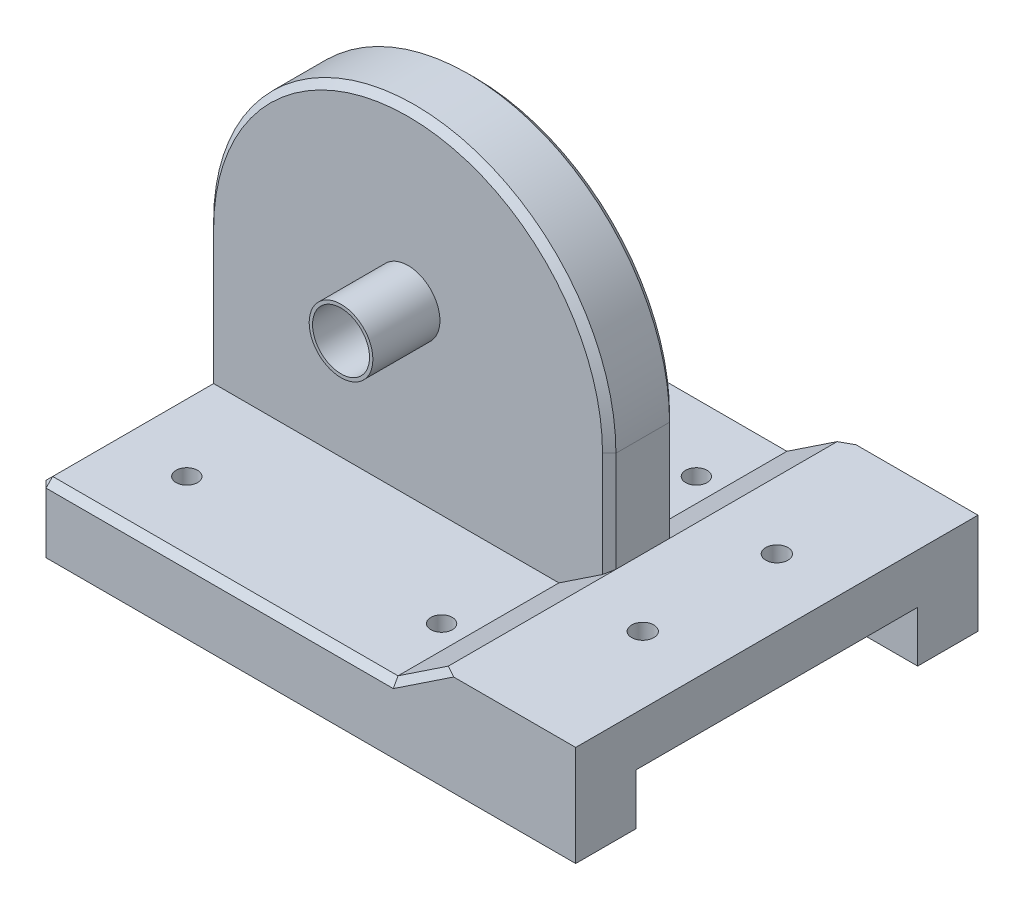
from build123d import *

# Parameters (mm, degrees)
SKETCH_1_W          = 60
SKETCH_1_H          = 50
EXTRUDE_1_DEPTH     = 10
SKETCH_8_W          = 80
SKETCH_8_H          = 60
EXTRUDE_2_DEPTH     = 10
SKETCH_9_R          = 4.75
SKETCH_9_R_2        = 4.25
EXTRUDE_3_DEPTH     = 10
SKETCH_11_W         = 20
SKETCH_11_H         = 7.6
CUT_EXTRUDE_1_DEPTH = 21
SKETCH_12_W         = 20
SKETCH_12_H         = 5
EXTRUDE_4_DEPTH     = 30
HOLE_WIZARD_4_D     = 3.3
EXTRUDE_START       = -60
EXTRUDE_5_DEPTH     = 60
FILLET_1_RADIUS     = 30
FILLET_1_LENGTH     = 10
CHAMFER_1_SIZE      = 1
HOLE_WIZARD_5_D     = 3.2


with BuildPart() as part:
    # 草图1 → 凸台-拉伸1 (new body)
    with BuildSketch(Plane.XY):
        Rectangle(SKETCH_1_W, SKETCH_1_H)
    extrude(amount=EXTRUDE_1_DEPTH)

    # 草图3 → 孔1 (revolve, cut)
    with BuildSketch(Plane(origin=(0, 0, 10), x_dir=(0, -1, 0), z_dir=(1, 0, 0))):
        Polygon((0, 0), (0, 10), (4, 10), (4, 0.603553391), (4.25, 0), align=None)
    revolve(axis=Axis((0, 0, 16.445314094), (0, 0, -1)), mode=Mode.SUBTRACT)

    # 草图8 → 凸台-拉伸2 (add)
    with BuildSketch(Plane.XZ.offset(25)):
        with Locations((10, 5)):
            Rectangle(SKETCH_8_W, SKETCH_8_H)
    extrude(amount=EXTRUDE_2_DEPTH)

    # 草图9 → 凸台-拉伸3 (add)
    with BuildSketch(Plane.XY.offset(10)):
        with Locations(Location((0, 0, 0), (0, 0, 180))):
            Circle(SKETCH_9_R)
        Circle(SKETCH_9_R_2, mode=Mode.SUBTRACT)
    extrude(amount=EXTRUDE_3_DEPTH)

    # 草图11 → 切除-拉伸1 (cut, symmetric)
    with BuildSketch(Plane.XY.offset(5)):
        with Locations((40, -31.2)):
            Rectangle(SKETCH_11_W, SKETCH_11_H)
    extrude(amount=CUT_EXTRUDE_1_DEPTH, both=True, mode=Mode.SUBTRACT)

    # 草图12 → 凸台-拉伸4 (add, symmetric)
    with BuildSketch(Plane.XY.offset(5)):
        with Locations((40, -22.5)):
            Rectangle(SKETCH_12_W, SKETCH_12_H)
    extrude(amount=EXTRUDE_4_DEPTH, both=True)

    # 孔4 (through all)
    with Locations(Plane(origin=(0, -20, 0), x_dir=(1, 0, 0), z_dir=(0, 1, 0))):
        with Locations((40, -15), (40, 5)):
            Hole(HOLE_WIZARD_4_D / 2)

    # 草图15 → 凸台-拉伸5 (add)
    with BuildSketch(Plane.XY.offset(35).offset(EXTRUDE_START)):
        Polygon((30, -20), (22.5, -25), (30, -25), align=None)
    extrude(amount=EXTRUDE_5_DEPTH)

    # 圆角1: full round fillet: the end face becomes a half cylinder, R = half its width
    fillet_1_face = Plane((0, 25, 5), x_dir=(0, 0, 1), z_dir=(0, 1, 0))  # on the end face: x along it, z out of the body
    fillet_1_slab = fillet_1_face.offset(-FILLET_1_RADIUS / 2) * Box(FILLET_1_LENGTH, 2 * FILLET_1_RADIUS, FILLET_1_RADIUS, mode=Mode.PRIVATE)  # the body's end, R deep
    fillet_1_round = Plane((0, -5, 5), x_dir=(0, 1, 0), z_dir=(0, 0, 1)) * Cylinder(FILLET_1_RADIUS, FILLET_1_LENGTH, mode=Mode.PRIVATE)  # its axis R under the face
    add(fillet_1_slab - fillet_1_round, mode=Mode.SUBTRACT)

    # 倒角1
    chamfer_1_edges = [part.edges().sort_by_distance(p)[0] for p in [
        (26.25, -22.5, -25),
        (26.25, -22.5, 35),
        (-30, -15, 0),
        (-30, -15, 10),
        (0, 25, 10),
        (0, 25, 0),
        (-30, -25, 22.5),
        (-30, -25, -12.5),
        (-30, -30, 35),
        (-3.75, -25, -25),
        (-30, -30, -25),
        (30, -12.5, 0),
        (30, -12.5, 10),
        (-3.75, -25, 35),
    ]]
    chamfer(chamfer_1_edges, length=CHAMFER_1_SIZE)

    # 孔5 (through all)
    with Locations(Plane(origin=(0, -25, 0), x_dir=(1, 0, 0), z_dir=(0, 1, 0))):
        with Locations((-19, 14), (19, 14), (19, -24), (-19, -24)):
            Hole(HOLE_WIZARD_5_D / 2)


solid = part.part
